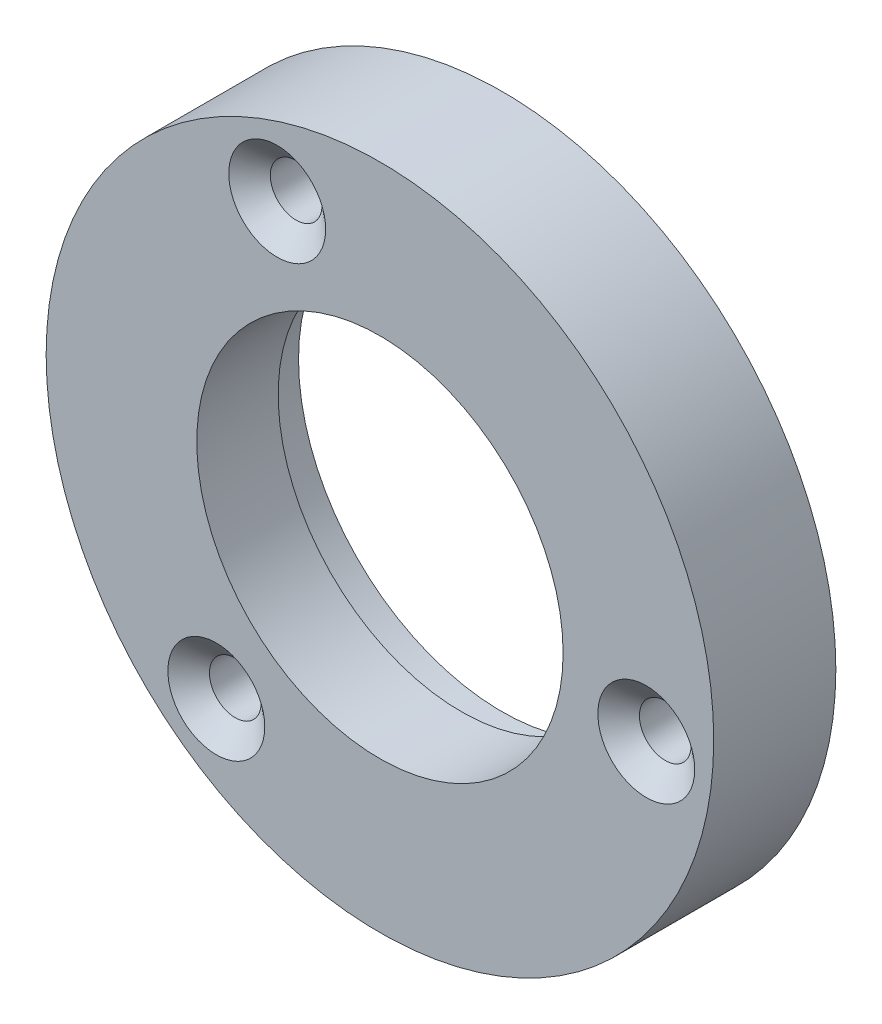
from build123d import *

# Parameters (mm, degrees)
SKETCH1_R                                         = 10.414
BOSS_EXTRUDE1_DEPTH                               = 3.81
SKETCH2_R                                         = 5.715
CUT_EXTRUDE1_DEPTH                                = 16.212458447
SKETCH3_R                                         = 6.35
CUT_EXTRUDE3_DEPTH                                = 1.27
CSK_FOR_0_FLAT_HEAD_MACHINE_SCREW_100_D           = 1.6129
CSK_FOR_0_FLAT_HEAD_MACHINE_SCREW_100_CSINK_D     = 3.0226
CSK_FOR_0_FLAT_HEAD_MACHINE_SCREW_100_CSINK_ANGLE = 100
CIRPATTERN1_COUNT                                 = 3


with BuildPart() as part:
    # Sketch1 → Boss-Extrude1 (new body)
    with BuildSketch(Plane.XY):
        with Locations(Location((0, 0, 0), (0, 0, 180))):
            Circle(SKETCH1_R)
    extrude(amount=BOSS_EXTRUDE1_DEPTH)

    # Sketch2 → Cut-Extrude1 (cut, through all)
    with BuildSketch(Plane.XY.offset(3.81)):
        Circle(SKETCH2_R)
    extrude(amount=-CUT_EXTRUDE1_DEPTH, mode=Mode.SUBTRACT)

    # Sketch3 → Cut-Extrude3 (cut)
    with BuildSketch(Plane(origin=(0, 0, 0), x_dir=(-1, 0, 0), z_dir=(0, 0, -1))):
        Circle(SKETCH3_R)
    extrude(amount=-CUT_EXTRUDE3_DEPTH, mode=Mode.SUBTRACT)

    # CSK for #0 Flat Head Machine Screw (100)1 (through all)
    with Locations(Plane.XY.offset(3.81)):
        with Locations((-5.104644358, -6.648347913)):
            csk_for_0_flat_head_machine_screw_100 = CounterSinkHole(CSK_FOR_0_FLAT_HEAD_MACHINE_SCREW_100_D / 2, CSK_FOR_0_FLAT_HEAD_MACHINE_SCREW_100_CSINK_D / 2, counter_sink_angle=CSK_FOR_0_FLAT_HEAD_MACHINE_SCREW_100_CSINK_ANGLE)

    # CirPattern1: CSK for #0 Flat Head Machine Screw (100)1 ×3 about axis
    cirpattern1_axis = Axis((0, 0, 0), (0, 0, 1))
    for i in range(1, CIRPATTERN1_COUNT):
        add(csk_for_0_flat_head_machine_screw_100.rotate(cirpattern1_axis, i * 360 / CIRPATTERN1_COUNT), mode=Mode.SUBTRACT)


solid = part.part
